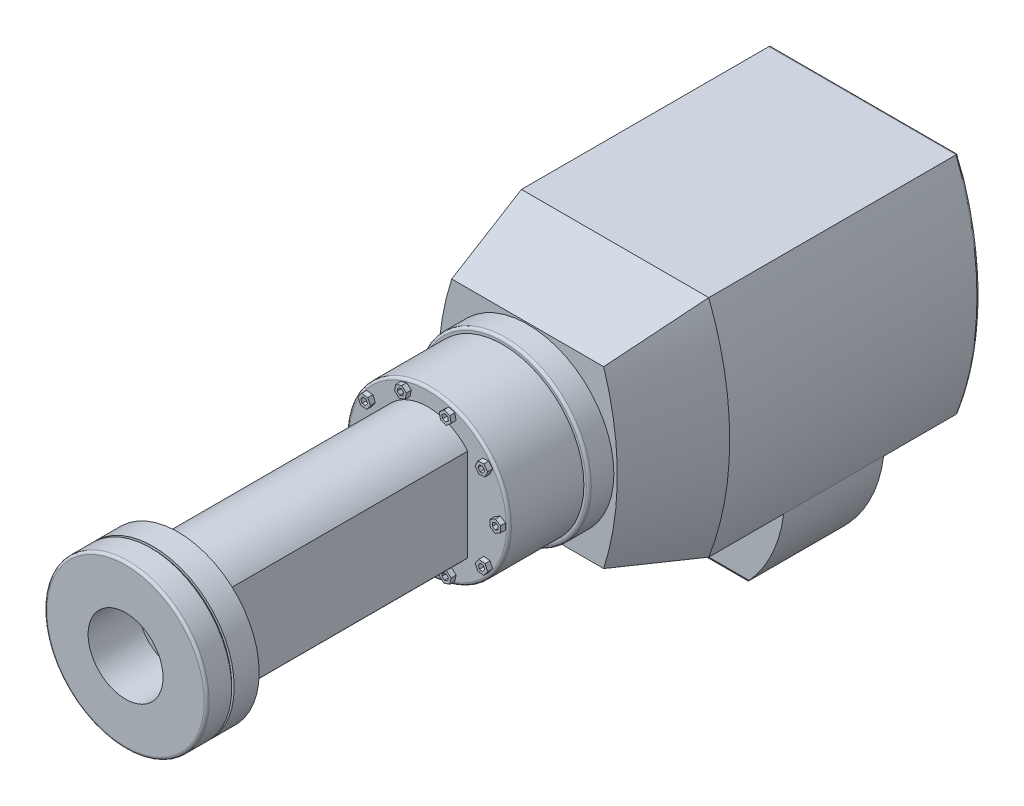
from build123d import *

# Parameters (mm, degrees)
BOSS_EXTRUDE1_DEPTH  = 100
SKETCH4_R            = 34.5
BOSS_EXTRUDE2_DEPTH  = 10
SKETCH5_R            = 32.5
BOSS_EXTRUDE3_DEPTH  = 30
BOSS_EXTRUDE5_DEPTH  = 2
CIRPATTERN1_COUNT    = 10
BOSS_EXTRUDE6_DEPTH  = 100
SKETCH8_R            = 32.5
BOSS_EXTRUDE7_DEPTH  = 10
SKETCH9_R            = 31.5
BOSS_EXTRUDE8_DEPTH  = 1
SKETCH10_R           = 32.5
BOSS_EXTRUDE9_DEPTH  = 10
SKETCH11_R           = 42.5
BOSS_EXTRUDE10_DEPTH = 10.5
BOSS_EXTRUDE11_DEPTH = 35
BOSS_EXTRUDE12_DEPTH = 20
CUT_EXTRUDE1_DEPTH   = 314.700892617
FILLET1_R            = 1
SKETCH15_R           = 15
CUT_EXTRUDE2_DEPTH   = 20
SKETCH16_R           = 15
CUT_EXTRUDE4_DEPTH   = 20


with BuildPart() as part:
    # Sketch1 → Boss-Extrude1 (new body)
    with BuildSketch(Plane.XY):
        with BuildLine():
            Line((-37.5, 45), (37.5, 45))
            ThreePointArc((37.5, 45), (45.880962103, 0), (37.5, -45))
            Line((37.5, -45), (-37.5, -45))
            ThreePointArc((-37.5, -45), (-45.880962103, 0), (-37.5, 45))
        make_face()
    extrude(amount=BOSS_EXTRUDE1_DEPTH)

    # Sketch3 for Loft1 → Loft1 section 0
    with BuildSketch(Plane.XY.offset(135)):
        with BuildLine():
            Line((30.425473604, 35), (-30.425473604, 35))
            # circular arc as an exact rational Bezier (weights 1, cos(half-angle), 1)
            Bezier((-30.425473604, 35), (-41.608142487, 0), (-30.425473604, -35), weights=[1, 0.95256097, 1])
            Line((-30.425473604, -35), (30.425473604, -35))
            Bezier((30.425473604, -35), (41.608142487, 0), (30.425473604, 35), weights=[1, 0.95256097, 1])
        make_face()
    # Sketch2 for Loft1 → Loft1 section 1
    with BuildSketch(Plane.XY.offset(100)):
        with BuildLine():
            Line((37.5, 45), (-37.5, 45))
            Bezier((-37.5, 45), (-54.864231746, 0), (-37.5, -45), weights=[1, 0.932952303, 1])
            Line((-37.5, -45), (37.5, -45))
            Bezier((37.5, -45), (54.864231746, 0), (37.5, 45), weights=[1, 0.932952303, 1])
        make_face()
    loft()

    # Sketch4 → Boss-Extrude2 (add)
    with BuildSketch(Plane.XY.offset(135)):
        Circle(SKETCH4_R)
    extrude(amount=BOSS_EXTRUDE2_DEPTH)

    # Sketch5 → Boss-Extrude3 (add)
    with BuildSketch(Plane.XY.offset(145)):
        Circle(SKETCH5_R)
    extrude(amount=BOSS_EXTRUDE3_DEPTH)

    # Sketch6 → Boss-Extrude5 (add)
    with BuildSketch(Plane.XY.offset(175)):
        Polygon((29, 2.5), (26.834936491, 1.25), (26.834936491, -1.25), (29, -2.5), (31.165063509, -1.25), (31.165063509, 1.25), align=None)
        Polygon((30.165063509, 0.672649731), (29, 1.345299462), (27.834936491, 0.672649731), (27.834936491, -0.672649731), (29, -1.345299462), (30.165063509, -0.672649731), align=None, mode=Mode.SUBTRACT)
    boss_extrude5 = extrude(amount=BOSS_EXTRUDE5_DEPTH)

    # CirPattern1: Boss-Extrude5 ×10 about axis
    cirpattern1_axis = Axis((0, 0, 0), (0, 0, 1))
    for i in range(1, CIRPATTERN1_COUNT):
        add(boss_extrude5.rotate(cirpattern1_axis, i * 360 / CIRPATTERN1_COUNT))

    # Sketch7 → Boss-Extrude6 (add)
    with BuildSketch(Plane.XY.offset(175)):
        with BuildLine():
            Line((16, 18.5), (16, -18.5))
            ThreePointArc((16, -18.5), (0, -25.898529491), (-16, -18.5))
            Line((-16, -18.5), (-16, 18.5))
            ThreePointArc((-16, 18.5), (0, 25.898529491), (16, 18.5))
        make_face()
    extrude(amount=BOSS_EXTRUDE6_DEPTH)

    # Sketch8 → Boss-Extrude7 (add)
    with BuildSketch(Plane.XY.offset(275)):
        Circle(SKETCH8_R)
    extrude(amount=BOSS_EXTRUDE7_DEPTH)

    # Sketch9 → Boss-Extrude8 (add)
    with BuildSketch(Plane.XY.offset(285)):
        Circle(SKETCH9_R)
    extrude(amount=BOSS_EXTRUDE8_DEPTH)

    # Sketch10 → Boss-Extrude9 (add)
    with BuildSketch(Plane.XY.offset(286)):
        Circle(SKETCH10_R)
    extrude(amount=BOSS_EXTRUDE9_DEPTH)

    # Sketch11 → Boss-Extrude10 (add, symmetric)
    with BuildSketch(Plane(origin=(-37.5, 0, 0), x_dir=(0, 0, -1), z_dir=(1, 0, 0))):
        with Locations((-50, -45)):
            Circle(SKETCH11_R)
    extrude(amount=BOSS_EXTRUDE10_DEPTH, both=True)

    # Sketch12 → Boss-Extrude11 (add)
    with BuildSketch(Plane(origin=(-27, 0, 0), x_dir=(0, 0, -1), z_dir=(1, 0, 0))):
        with BuildLine():
            Line((-70, -45), (-70, -75))
            ThreePointArc((-70, -75), (-50, -85.128852225), (-30, -75))
            Line((-30, -75), (-30, -45))
            Line((-30, -45), (-70, -45))
        make_face()
    extrude(amount=BOSS_EXTRUDE11_DEPTH)

    # Sketch13 → Boss-Extrude12 (add, symmetric)
    with BuildSketch(Plane.XY.offset(50)):
        with BuildLine():
            Line((8, -87), (8, -45))
            Line((8, -45), (37.5, -45))
            ThreePointArc((37.5, -45), (27.949541719, -69.652059065), (8, -87))
        make_face()
    extrude(amount=BOSS_EXTRUDE12_DEPTH, both=True)

    # Sketch14 → Cut-Extrude1 (cut, through all)
    with BuildSketch(Plane.ZY.offset(-8)):
        with BuildLine():
            Line((70, -87), (70, -75))
            ThreePointArc((70, -75), (50, -85.128852225), (30, -75))
            Line((30, -75), (30, -87))
            Line((30, -87), (70, -87))
        make_face()
    extrude(amount=-CUT_EXTRUDE1_DEPTH, mode=Mode.SUBTRACT)

    # Fillet1
    fillet1_edges = [part.edges().sort_by_distance(p)[0] for p in [
        (-34.5, 0, 145),
        (-32.5, 0, 175),
        (-32.5, 0, 296),
        (-48, -45, 92.5),
        (-27, -87.5, 50),
        (0, -45, 0),
        (-45.880962103, 0, 0),
        (0, 45, 0),
        (45.880962103, 0, 0),
    ]]
    fillet(fillet1_edges, radius=FILLET1_R)

    # Sketch15 → Cut-Extrude2 (cut)
    with BuildSketch(Plane.XY.offset(296)):
        Circle(SKETCH15_R)
    extrude(amount=-CUT_EXTRUDE2_DEPTH, mode=Mode.SUBTRACT)

    # Sketch16 → Cut-Extrude4 (cut)
    with BuildSketch(Plane.ZY.offset(48)):
        with Locations((50, -45)):
            Circle(SKETCH16_R)
    extrude(amount=-CUT_EXTRUDE4_DEPTH, mode=Mode.SUBTRACT)


solid = part.part
